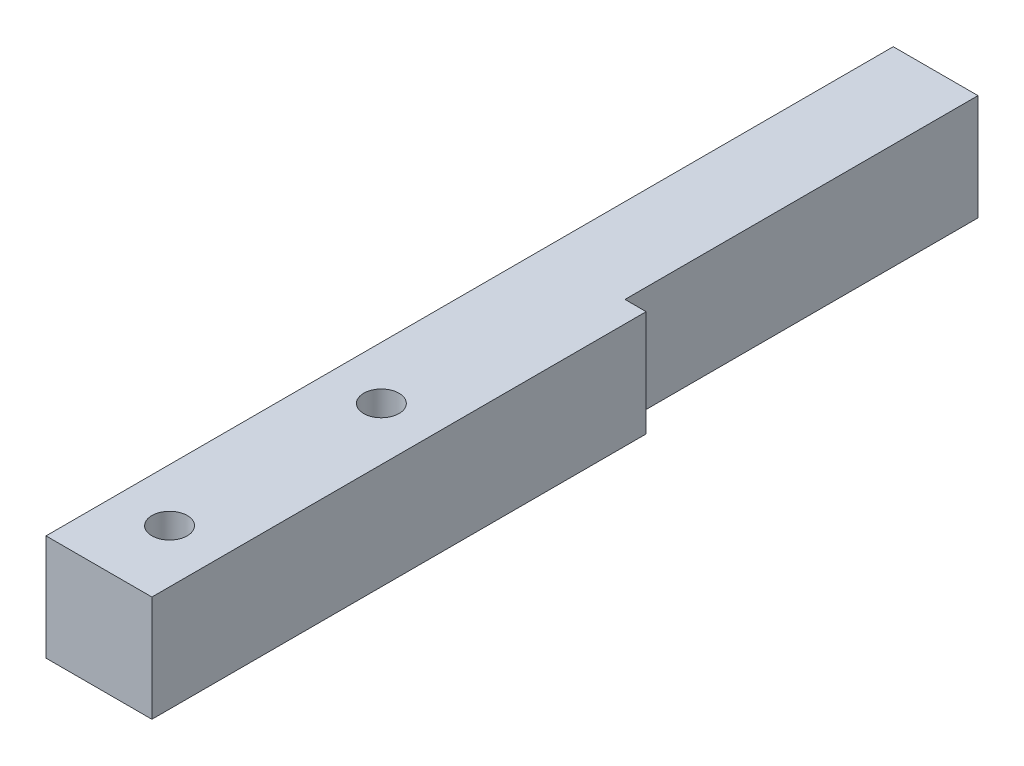
from build123d import *

# Parameters (mm, degrees)
SKETCH1_W           = 19.05
SKETCH1_H           = 19.05
BOSS_EXTRUDE1_DEPTH = 152.4
SKETCH3_R           = 3.175
SKETCH3_W           = 3.81
SKETCH3_H           = 63.5
CUT_EXTRUDE1_DEPTH  = 25.4


with BuildPart() as part:
    # Sketch1 → Boss-Extrude1 (new body)
    with BuildSketch(Plane.XY):
        Rectangle(SKETCH1_W, SKETCH1_H)
    extrude(amount=BOSS_EXTRUDE1_DEPTH)

    # Sketch3 → Cut-Extrude1 (cut)
    with BuildSketch(Plane.XZ.offset(9.525)):
        with Locations(Location((0, 139.7, 0), (0, 0, 270))):
            Circle(SKETCH3_R)
        with Locations(Location((0, 101.6, 0), (0, 0, 270))):
            Circle(SKETCH3_R)
        with Locations((7.62, 31.75)):
            Rectangle(SKETCH3_W, SKETCH3_H)
    extrude(amount=-CUT_EXTRUDE1_DEPTH, mode=Mode.SUBTRACT)


solid = part.part
